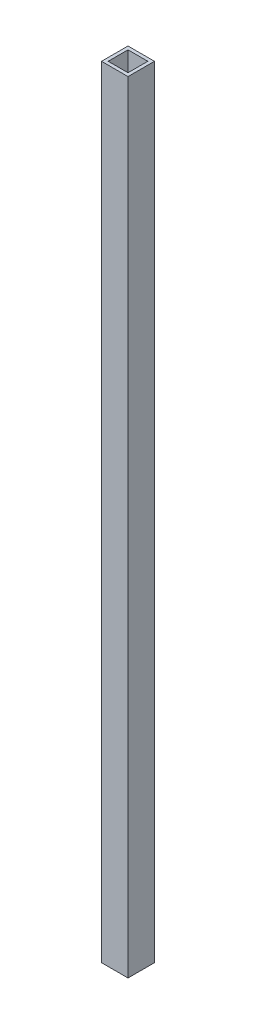
from build123d import *

# Parameters (mm, degrees)
SKETCH1_W           = 25.4
SKETCH1_H           = 25.4
SKETCH1_W_2         = 19.05
SKETCH1_H_2         = 19.05
BOSS_EXTRUDE1_DEPTH = 749.3


with BuildPart() as part:
    # Sketch1 → Boss-Extrude1 (new body)
    with BuildSketch(Plane(origin=(0, 0, 0), x_dir=(1, 0, 0), z_dir=(0, 1, 0))):
        Rectangle(SKETCH1_W, SKETCH1_H)
        Rectangle(SKETCH1_W_2, SKETCH1_H_2, mode=Mode.SUBTRACT)
    extrude(amount=BOSS_EXTRUDE1_DEPTH)


solid = part.part
